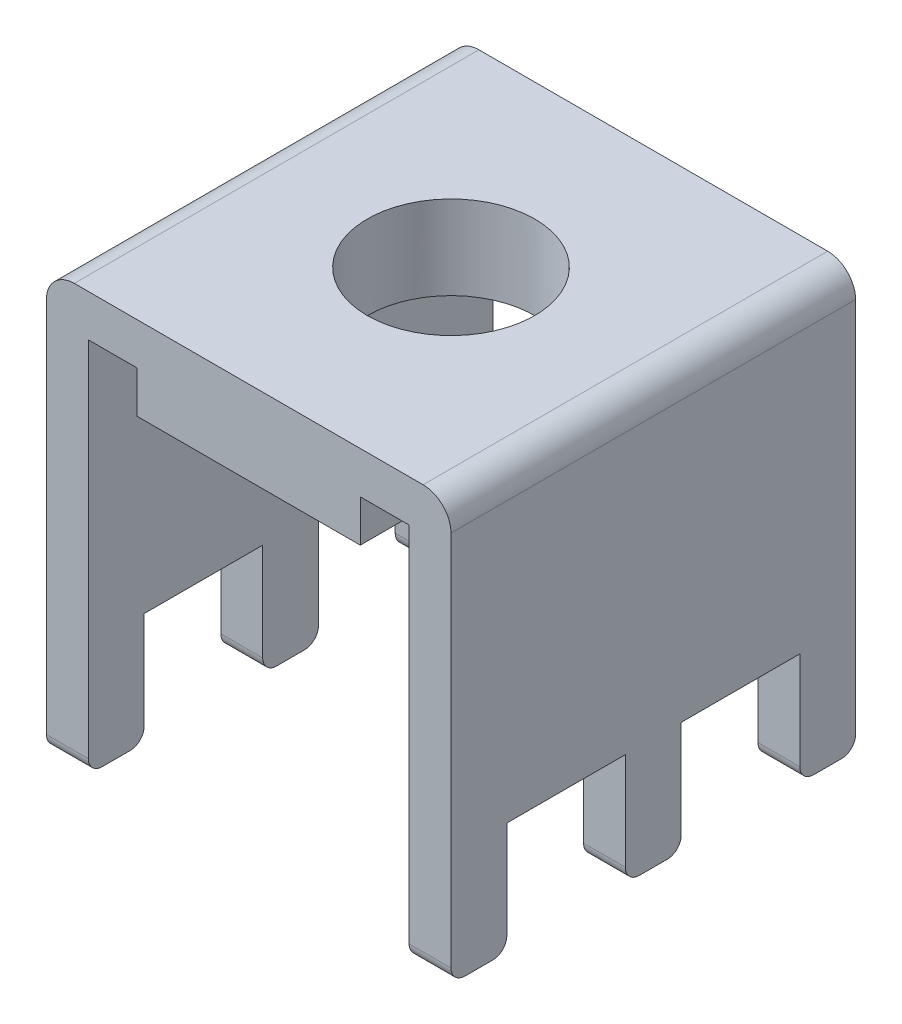
from build123d import *

# Parameters (mm, degrees)
BOSS_EXTRUDE1_DEPTH = 14.5
CUT_EXTRUDE1_REACH  = 27.407
SKETCH2_W           = 4.25
SKETCH2_H           = 4
FILLET1_R           = 0.5
SKETCH3_R           = 3
CUT_EXTRUDE2_DEPTH  = 3


with BuildPart() as part:
    # Sketch1 → Boss-Extrude1 (new body)
    with BuildSketch(Plane.XY):
        with BuildLine():
            Line((0, 0), (-1.5, 0))
            Line((-1.5, 0), (-1.5, 14))
            ThreePointArc((-1.5, 14), (-1.207106781, 14.707106781), (-0.5, 15))
            Line((-0.5, 15), (12, 15))
            ThreePointArc((12, 15), (12.707106781, 14.707106781), (13, 14))
            Line((13, 14), (13, 0))
            Line((13, 0), (11.5, 0))
            Line((11.5, 0), (11.5, 13.5))
            Line((11.5, 13.5), (9.75, 13.5))
            Line((9.75, 13.5), (9.75, 12))
            Line((9.75, 12), (1.75, 12))
            Line((1.75, 12), (1.75, 13.5))
            Line((1.75, 13.5), (0, 13.5))
            Line((0, 13.5), (0, 0))
        make_face()
    extrude(amount=BOSS_EXTRUDE1_DEPTH)

    # Cut-Extrude1: up to this face of the body (flat: up to its plane)
    cut_extrude1_end = Plane(part.part.faces().sort_by_distance((-1.5, 7, 7.25))[0])
    # Sketch2 → Cut-Extrude1 (cut, up to the picked face)
    with BuildSketch(Plane(origin=(13, 0, 0), x_dir=(0, 0, -1), z_dir=(1, 0, 0)), mode=Mode.PRIVATE) as cut_extrude1_sk1:
        with Locations((-10.375, 2)):
            Rectangle(SKETCH2_W, SKETCH2_H)
    cut_extrude1_tool1 = split(extrude(cut_extrude1_sk1.sketch, amount=-CUT_EXTRUDE1_REACH, mode=Mode.PRIVATE), bisect_by=cut_extrude1_end, keep=Keep.BOTH, mode=Mode.PRIVATE)
    # Sketch2 → Cut-Extrude1 (cut, up to the picked face)
    with BuildSketch(Plane(origin=(13, 0, 0), x_dir=(0, 0, -1), z_dir=(1, 0, 0)), mode=Mode.PRIVATE) as cut_extrude1_sk2:
        with Locations((-4.125, 2)):
            Rectangle(SKETCH2_W, SKETCH2_H)
    cut_extrude1_tool2 = split(extrude(cut_extrude1_sk2.sketch, amount=-CUT_EXTRUDE1_REACH, mode=Mode.PRIVATE), bisect_by=cut_extrude1_end, keep=Keep.BOTH, mode=Mode.PRIVATE)
    add(cut_extrude1_tool1.solids().sort_by(Axis((13, 2, 10.375), (-1, 0, 0)))[0], mode=Mode.SUBTRACT)
    add(cut_extrude1_tool2.solids().sort_by(Axis((13, 2, 4.125), (-1, 0, 0)))[0], mode=Mode.SUBTRACT)

    # Fillet1
    fillet1_edges = [part.edges().sort_by_distance(p)[0] for p in [
        (-0.75, 0, 0),
        (12.25, 0, 0),
        (12.25, 0, 14.5),
        (-0.75, 0, 14.5),
        (-0.75, 0, 8.25),
        (12.25, 0, 8.25),
        (-0.75, 0, 12.5),
        (12.25, 0, 12.5),
        (-0.75, 0, 2),
        (12.25, 0, 2),
        (-0.75, 0, 6.25),
        (12.25, 0, 6.25),
    ]]
    fillet(fillet1_edges, radius=FILLET1_R)

    # Sketch3 → Cut-Extrude2 (cut)
    with BuildSketch(Plane(origin=(0, 15, 0), x_dir=(1, 0, 0), z_dir=(0, 1, 0))):
        with Locations(Location((5.75, -7.25, 0), (0, 0, 270))):
            Circle(SKETCH3_R)
    extrude(amount=-CUT_EXTRUDE2_DEPTH, mode=Mode.SUBTRACT)


solid = part.part
